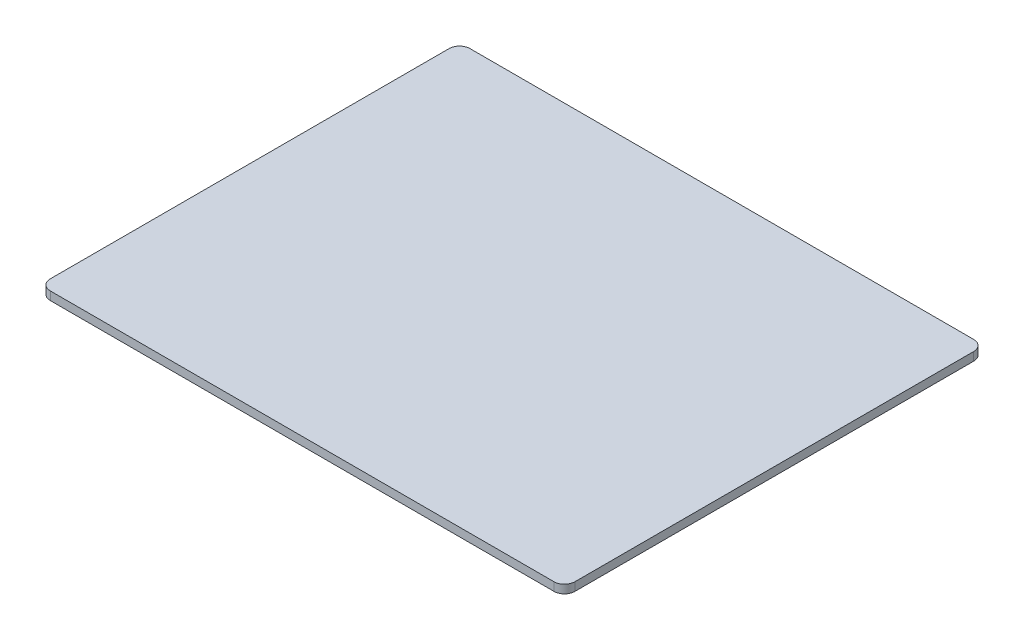
from build123d import *

# Parameters (mm, degrees)
SKETCH_1_W      = 100
SKETCH_1_H      = 80
EXTRUDE_1_DEPTH = 1.6
FILLET_1_R      = 2


with BuildPart() as part:
    # 草图1 → 凸台-拉伸1 (new body)
    with BuildSketch(Plane(origin=(0, 0, 0), x_dir=(1, 0, 0), z_dir=(0, 1, 0))):
        Rectangle(SKETCH_1_W, SKETCH_1_H)
    extrude(amount=EXTRUDE_1_DEPTH)

    # 圆角1
    fillet_1_edges = [part.edges().sort_by_distance(p)[0] for p in [
        (50, 0.8, 40),
        (-50, 0.8, 40),
        (-50, 0.8, -40),
        (50, 0.8, -40),
    ]]
    fillet(fillet_1_edges, radius=FILLET_1_R)


solid = part.part
